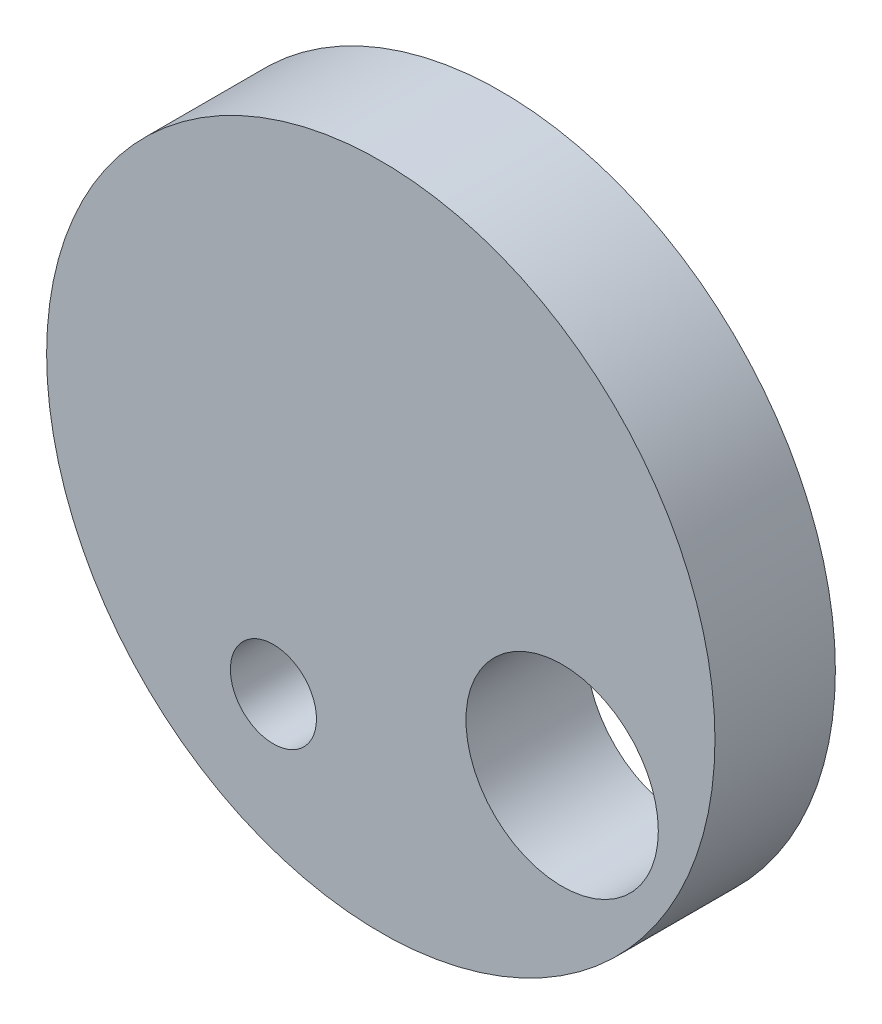
from build123d import *

# Parameters (mm, degrees)
CROQUIS1_R              = 55.5
CROQUIS1_R_2            = 7.149784922
CROQUIS1_R_3            = 15.975982674
SALIENTE_EXTRUIR1_DEPTH = 20


with BuildPart() as part:
    # Croquis1 → Saliente-Extruir1 (new body)
    with BuildSketch(Plane.XY):
        Circle(CROQUIS1_R)
        with Locations((-17.83018167, -30.117845567)):
            Circle(CROQUIS1_R_2, mode=Mode.SUBTRACT)
        with Locations((30.117845567, -17.83018167)):
            Circle(CROQUIS1_R_3, mode=Mode.SUBTRACT)
    extrude(amount=SALIENTE_EXTRUIR1_DEPTH)


solid = part.part
